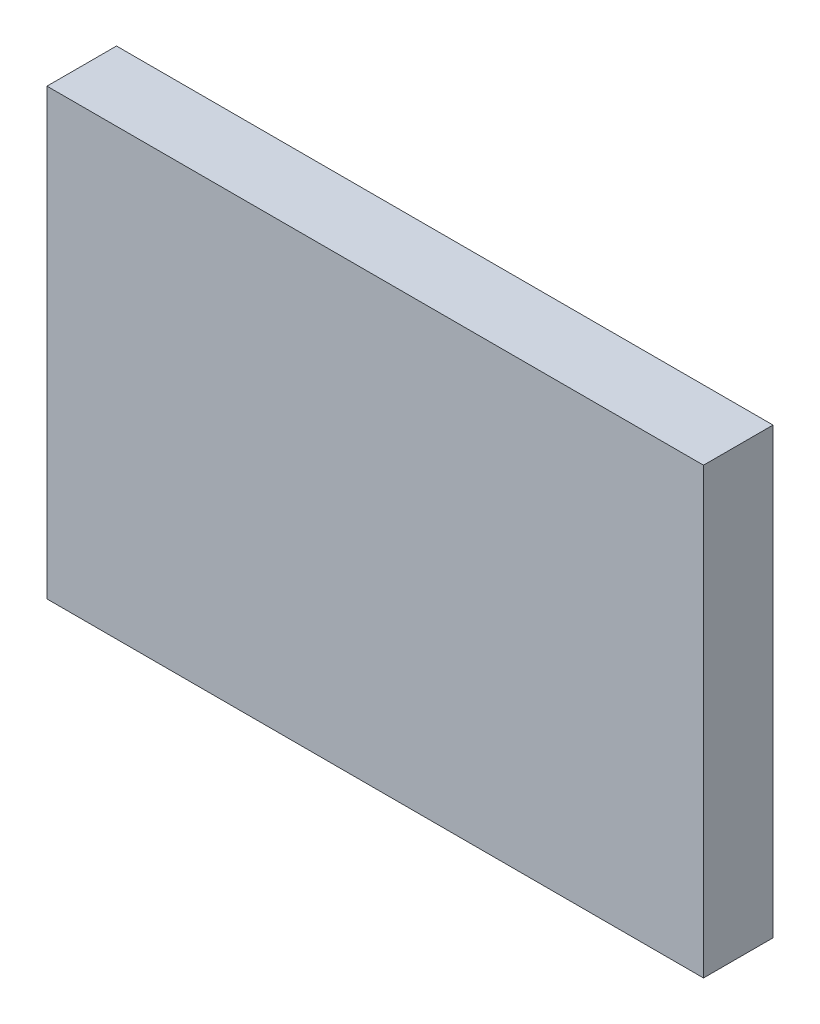
from build123d import *

# Parameters (mm, degrees)
CROQUIS1_W              = 170
CROQUIS1_H              = 115
SALIENTE_EXTRUIR1_DEPTH = 18


with BuildPart() as part:
    # Croquis1 → Saliente-Extruir1 (new body)
    with BuildSketch(Plane.XY):
        Rectangle(CROQUIS1_W, CROQUIS1_H)
    extrude(amount=SALIENTE_EXTRUIR1_DEPTH)


solid = part.part
